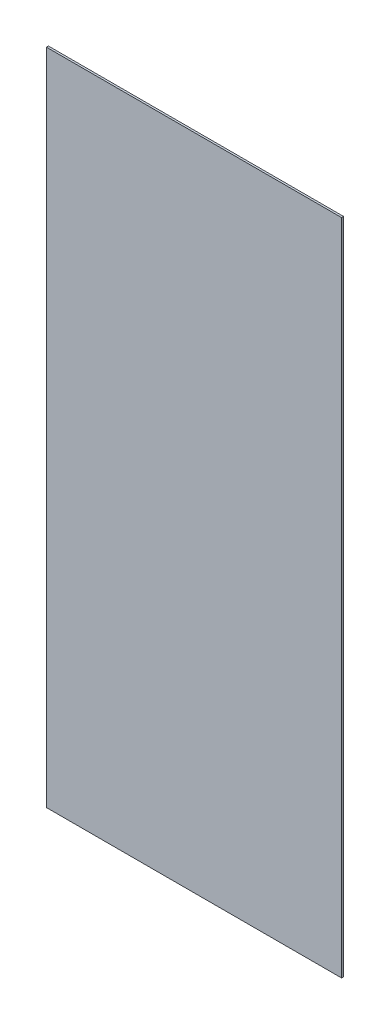
from build123d import *

# Parameters (mm, degrees)
SKETCH_1_W      = 74.5
SKETCH_1_H      = 166.2
EXTRUDE_1_DEPTH = 0.25


with BuildPart() as part:
    # 草图1 → 凸台-拉伸1 (new, symmetric)
    with BuildSketch(Plane.XY):
        Rectangle(SKETCH_1_W, SKETCH_1_H)
    extrude(amount=EXTRUDE_1_DEPTH, both=True)


solid = part.part
